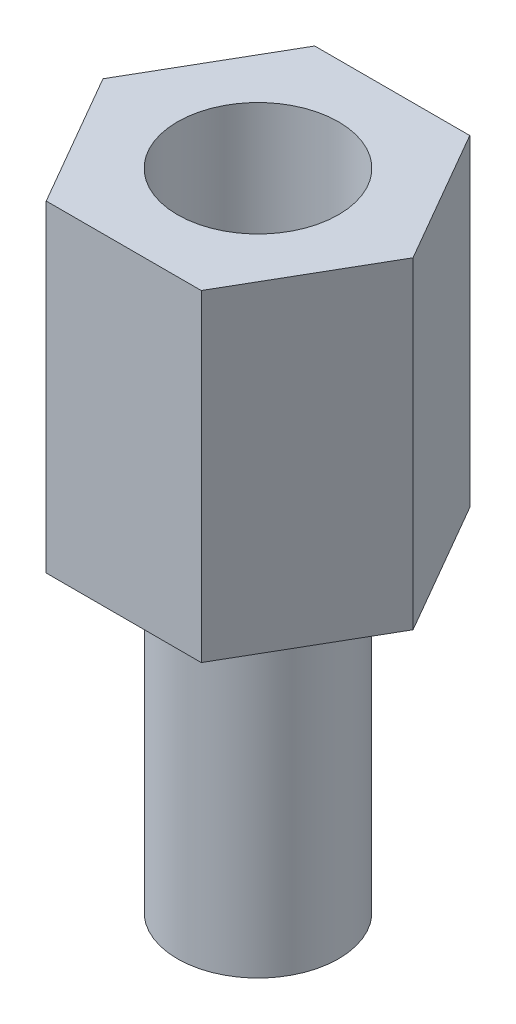
from build123d import *

# Parameters (mm, degrees)
CROQUIS1_R              = 1.5
SALIENTE_EXTRUIR1_DEPTH = 6
CROQUIS2_R              = 1.5
SALIENTE_EXTRUIR2_DEPTH = 6


with BuildPart() as part:
    # Croquis1 → Saliente-Extruir1 (new body)
    with BuildSketch(Plane(origin=(0, 0, 0), x_dir=(1, 0, 0), z_dir=(0, 1, 0))):
        Polygon((1.443375673, -2.5), (2.886751346, 0), (1.443375673, 2.5), (-1.443375673, 2.5), (-2.886751346, 0), (-1.443375673, -2.5), align=None)
        with Locations(Location((0, 0, 0), (0, 0, 270))):
            Circle(CROQUIS1_R, mode=Mode.SUBTRACT)
    extrude(amount=SALIENTE_EXTRUIR1_DEPTH)


with BuildPart() as body_2:
    # Croquis2 → Saliente-Extruir2 (new body)
    with BuildSketch(Plane.XZ):
        with Locations(Location((0, 0, 0), (0, 0, 270))):
            Circle(CROQUIS2_R)
    extrude(amount=SALIENTE_EXTRUIR2_DEPTH)


solid = Compound([part.part, body_2.part])
